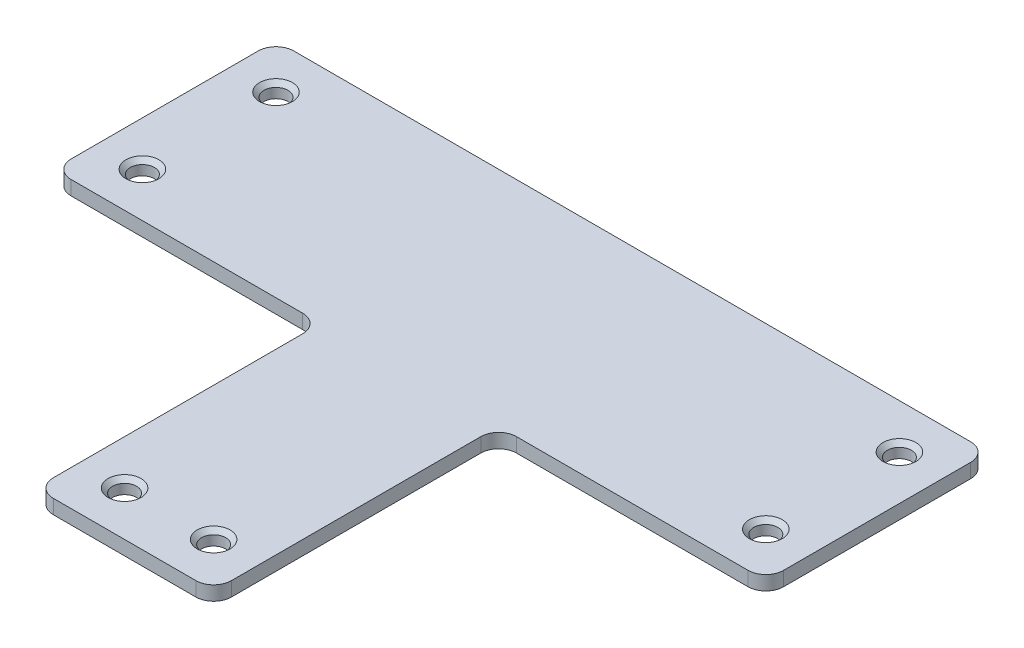
from build123d import *

# Parameters (mm, degrees)
SKETCH1_W           = 80
SKETCH1_H           = 25
BOSS_EXTRUDE1_DEPTH = 1.6
SKETCH2_W           = 20
SKETCH2_H           = 32
BOSS_EXTRUDE2_DEPTH = 1.6
SKETCH3_R           = 1.35
CUT_EXTRUDE1_DEPTH  = 1.6
SKETCH4_R           = 1.35
CUT_EXTRUDE2_DEPTH  = 1.6
SKETCH5_R           = 1.35
CUT_EXTRUDE3_DEPTH  = 1.6
SKETCH6_R           = 1.35
CUT_EXTRUDE4_DEPTH  = 1.6
SKETCH7_R           = 1.35
CUT_EXTRUDE5_DEPTH  = 1.6
SKETCH8_R           = 1.35
CUT_EXTRUDE6_DEPTH  = 1.6
CHAMFER1_SIZE       = 0.5
FILLET1_R           = 2


with BuildPart() as part:
    # Sketch1 → Boss-Extrude1 (new body)
    with BuildSketch(Plane(origin=(0, 0, 0), x_dir=(1, 0, 0), z_dir=(0, 1, 0))):
        Rectangle(SKETCH1_W, SKETCH1_H)
    extrude(amount=BOSS_EXTRUDE1_DEPTH)

    # Sketch2 → Boss-Extrude2 (add)
    with BuildSketch(Plane(origin=(0, 1.6, 0), x_dir=(1, 0, 0), z_dir=(0, 1, 0))):
        with Locations((0, -28.5)):
            Rectangle(SKETCH2_W, SKETCH2_H)
    extrude(amount=-BOSS_EXTRUDE2_DEPTH)

    # Sketch3 → Cut-Extrude1 (cut)
    with BuildSketch(Plane(origin=(0, 1.6, 0), x_dir=(1, 0, 0), z_dir=(0, 1, 0))):
        with Locations(Location((-35, 7.5, 0), (0, 0, 270))):
            Circle(SKETCH3_R)
    extrude(amount=-CUT_EXTRUDE1_DEPTH, mode=Mode.SUBTRACT)

    # Sketch4 → Cut-Extrude2 (cut)
    with BuildSketch(Plane(origin=(0, 1.6, 0), x_dir=(1, 0, 0), z_dir=(0, 1, 0))):
        with Locations(Location((35, 7.5, 0), (0, 0, 270))):
            Circle(SKETCH4_R)
    extrude(amount=-CUT_EXTRUDE2_DEPTH, mode=Mode.SUBTRACT)

    # Sketch5 → Cut-Extrude3 (cut)
    with BuildSketch(Plane(origin=(0, 1.6, 0), x_dir=(1, 0, 0), z_dir=(0, 1, 0))):
        with Locations(Location((-35, -7.5, 0), (0, 0, 270))):
            Circle(SKETCH5_R)
    extrude(amount=-CUT_EXTRUDE3_DEPTH, mode=Mode.SUBTRACT)

    # Sketch6 → Cut-Extrude4 (cut)
    with BuildSketch(Plane(origin=(0, 1.6, 0), x_dir=(1, 0, 0), z_dir=(0, 1, 0))):
        with Locations(Location((35, -7.5, 0), (0, 0, 270))):
            Circle(SKETCH6_R)
    extrude(amount=-CUT_EXTRUDE4_DEPTH, mode=Mode.SUBTRACT)

    # Sketch7 → Cut-Extrude5 (cut)
    with BuildSketch(Plane(origin=(0, 1.6, 0), x_dir=(1, 0, 0), z_dir=(0, 1, 0))):
        with Locations(Location((-5, -39.5, 0), (0, 0, 270))):
            Circle(SKETCH7_R)
    extrude(amount=-CUT_EXTRUDE5_DEPTH, mode=Mode.SUBTRACT)

    # Sketch8 → Cut-Extrude6 (cut)
    with BuildSketch(Plane(origin=(0, 1.6, 0), x_dir=(1, 0, 0), z_dir=(0, 1, 0))):
        with Locations(Location((5, -39.5, 0), (0, 0, 270))):
            Circle(SKETCH8_R)
    extrude(amount=-CUT_EXTRUDE6_DEPTH, mode=Mode.SUBTRACT)

    # Chamfer1
    chamfer1_edges = [part.edges().sort_by_distance(p)[0] for p in [
        (-35, 1.6, -8.85),
        (35, 1.6, -8.85),
        (-35, 1.6, 6.15),
        (35, 1.6, 6.15),
        (-5, 1.6, 38.15),
        (5, 1.6, 38.15),
    ]]
    chamfer(chamfer1_edges, length=CHAMFER1_SIZE)

    # Fillet1
    fillet1_edges = [part.edges().sort_by_distance(p)[0] for p in [
        (-40, 0.8, -12.5),
        (40, 0.8, -12.5),
        (40, 0.8, 12.5),
        (10, 0.8, 12.5),
        (10, 0.8, 44.5),
        (-10, 0.8, 44.5),
        (-10, 0.8, 12.5),
        (-40, 0.8, 12.5),
    ]]
    fillet(fillet1_edges, radius=FILLET1_R)


solid = part.part
